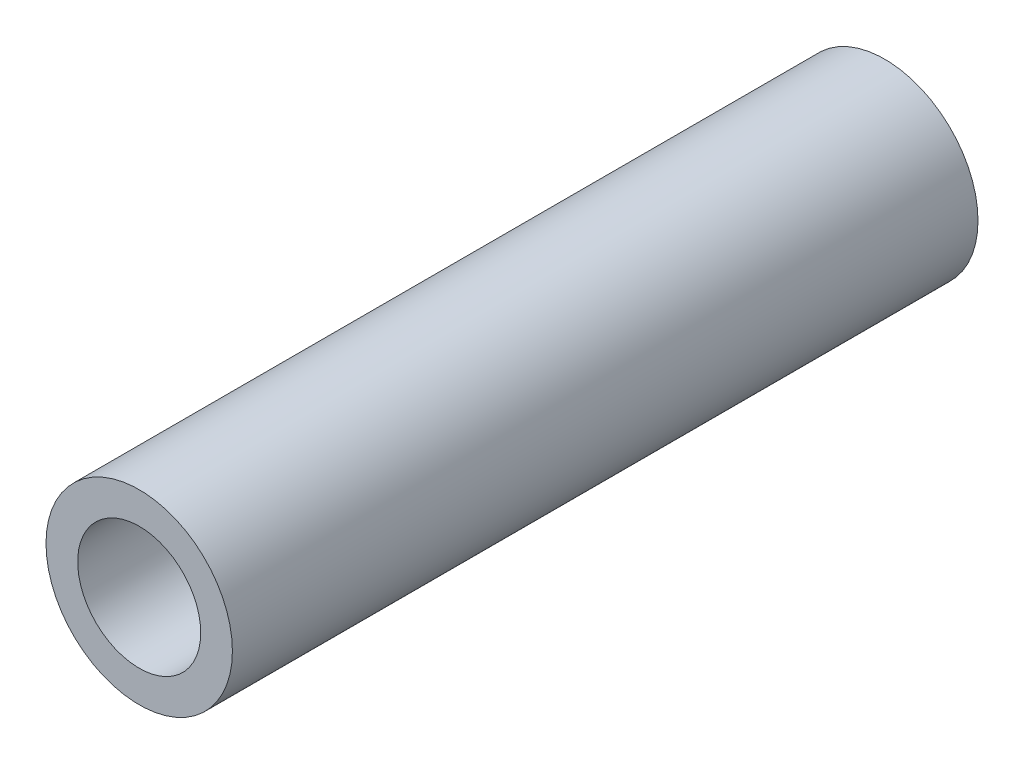
from build123d import *

# Parameters (mm, degrees)
SKETCH1_R           = 3.175
SKETCH1_R_2         = 2.0955
BOSS_EXTRUDE1_DEPTH = 12.7


with BuildPart() as part:
    # Sketch1 → Boss-Extrude1 (new, symmetric)
    with BuildSketch(Plane.XY):
        Circle(SKETCH1_R)
        Circle(SKETCH1_R_2, mode=Mode.SUBTRACT)
    extrude(amount=BOSS_EXTRUDE1_DEPTH, both=True)


solid = part.part
